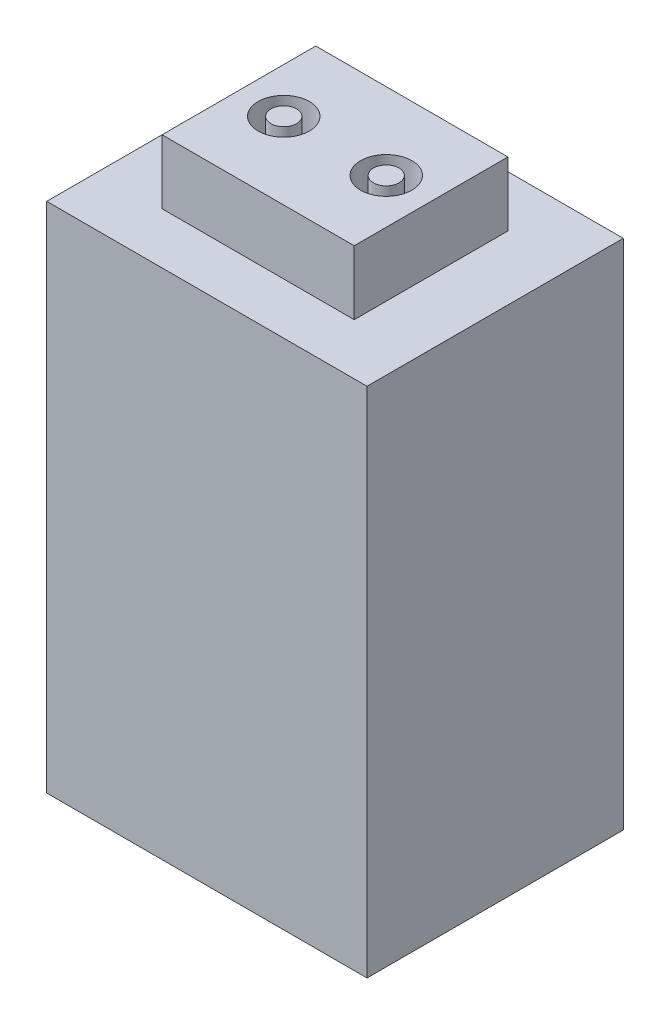
from build123d import *

# Parameters (mm, degrees)
SKETCH1_W           = 80
SKETCH1_H           = 50
BOSS_EXTRUDE1_DEPTH = 40
SKETCH2_W           = 30
SKETCH2_H           = 24
BOSS_EXTRUDE2_DEPTH = 10
SKETCH3_R           = 4
SKETCH3_R_2         = 2
CUT_EXTRUDE1_DEPTH  = 5


with BuildPart() as part:
    # Sketch1 → Boss-Extrude1 (new body)
    with BuildSketch(Plane(origin=(0, 0, 0), x_dir=(0, 1, 0), z_dir=(0, 0, 1))):
        with Locations((40, 25)):
            Rectangle(SKETCH1_W, SKETCH1_H)
    extrude(amount=BOSS_EXTRUDE1_DEPTH)

    # Sketch2 → Boss-Extrude2 (add)
    with BuildSketch(Plane(origin=(0, 80, 0), x_dir=(-1, 0, 0), z_dir=(0, 1, 0))):
        with Locations((25, 20)):
            Rectangle(SKETCH2_W, SKETCH2_H)
    extrude(amount=BOSS_EXTRUDE2_DEPTH)

    # Sketch3 → Cut-Extrude1 (cut)
    # profile 1 of 2: a face of its own
    with BuildSketch(Plane(origin=(0, 90, 0), x_dir=(-1, 0, 0), z_dir=(0, 1, 0))):
        with Locations(Location((17, 20, 0), (0, 0, 90))):
            Circle(SKETCH3_R)
        with Locations(Location((17, 20, 0), (0, 0, 90))):
            Circle(SKETCH3_R_2, mode=Mode.SUBTRACT)
    # profile 2 of 2: a face of its own
    with BuildSketch(Plane(origin=(0, 90, 0), x_dir=(-1, 0, 0), z_dir=(0, 1, 0))):
        with Locations(Location((33, 20, 0), (0, 0, 90))):
            Circle(SKETCH3_R)
        with Locations(Location((33, 20, 0), (0, 0, 90))):
            Circle(SKETCH3_R_2, mode=Mode.SUBTRACT)
    extrude(amount=-CUT_EXTRUDE1_DEPTH, mode=Mode.SUBTRACT)


solid = part.part
